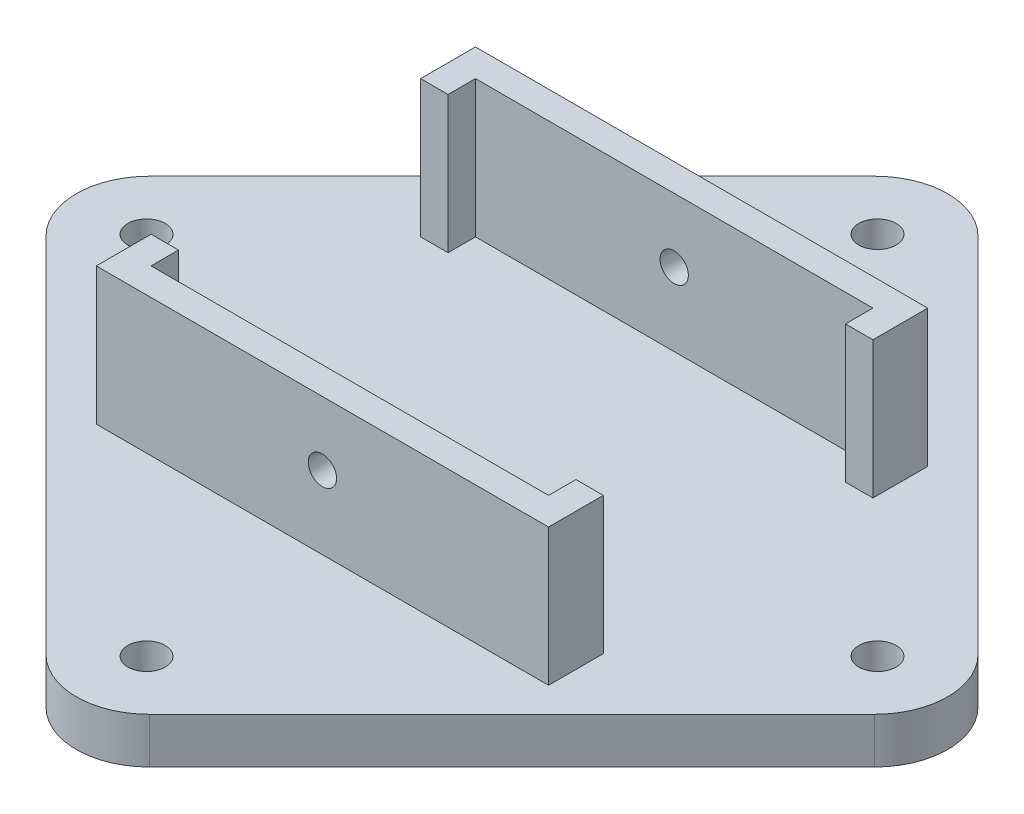
from build123d import *

# Parameters (mm, degrees)
SKETCH_1_R               = 2.05
EXTRUDE_1_DEPTH          = 5
EXTRUDE_2_DEPTH          = 15
CUT_EXTRUDE_1_DEPTH      = 86.775919648
CUT_EXTRUDE_1_DEPTH_BACK = 86.775919648
SKETCH_3_R               = 1.55


with BuildPart() as part:
    # 草图1 → 凸台-拉伸1 (new body)
    with BuildSketch(Plane(origin=(0, 0, 0), x_dir=(1, 0, 0), z_dir=(0, 1, 0))):
        with BuildLine():
            Line((-5.656854249, 45.343145751), (-45.343145751, 5.656854249))
            ThreePointArc((-45.343145751, 5.656854249), (-47.686291501, 0), (-45.343145751, -5.656854249))
            Line((-45.343145751, -5.656854249), (-5.656854249, -45.343145751))
            ThreePointArc((-5.656854249, -45.343145751), (0, -47.686291501), (5.656854249, -45.343145751))
            Line((5.656854249, -45.343145751), (45.343145751, -5.656854249))
            ThreePointArc((45.343145751, -5.656854249), (47.686291501, 0), (45.343145751, 5.656854249))
            Line((45.343145751, 5.656854249), (5.656854249, 45.343145751))
            ThreePointArc((5.656854249, 45.343145751), (0, 47.686291501), (-5.656854249, 45.343145751))
        make_face()
        with Locations(Location((0, 40, 0), (0, 0, 270))):
            Circle(SKETCH_1_R, mode=Mode.SUBTRACT)
        with Locations(Location((40, 0, 0), (0, 0, 270))):
            Circle(SKETCH_1_R, mode=Mode.SUBTRACT)
        with Locations(Location((0, -40, 0), (0, 0, 270))):
            Circle(SKETCH_1_R, mode=Mode.SUBTRACT)
        with Locations(Location((-40, 0, 0), (0, 0, 270))):
            Circle(SKETCH_1_R, mode=Mode.SUBTRACT)
    extrude(amount=EXTRUDE_1_DEPTH)

    # 草图2 → 凸台-拉伸2 (add)
    with BuildSketch(Plane(origin=(0, 5, 0), x_dir=(1, 0, 0), z_dir=(0, 1, 0))):
        Polygon((-24.75, 14.75), (-21.75, 14.75), (-21.75, 17.75), (21.75, 17.75), (21.75, 14.75), (24.75, 14.75), (24.75, 20.75), (-24.75, 20.75), align=None)
        Polygon((24.75, -20.75), (-24.75, -20.75), (-24.75, -14.75), (-21.75, -14.75), (-21.75, -17.75), (21.75, -17.75), (21.75, -14.75), (24.75, -14.75), align=None)
    extrude(amount=EXTRUDE_2_DEPTH)

    # 草图3 → 切除-拉伸1 (cut, two sides: drawn at the far end of the back side and taken through both)
    with BuildSketch(Plane.XY.offset(20.75).offset(-CUT_EXTRUDE_1_DEPTH_BACK)):
        with Locations((0, 13)):
            Circle(SKETCH_3_R)
    extrude(amount=CUT_EXTRUDE_1_DEPTH + CUT_EXTRUDE_1_DEPTH_BACK, mode=Mode.SUBTRACT)


solid = part.part
